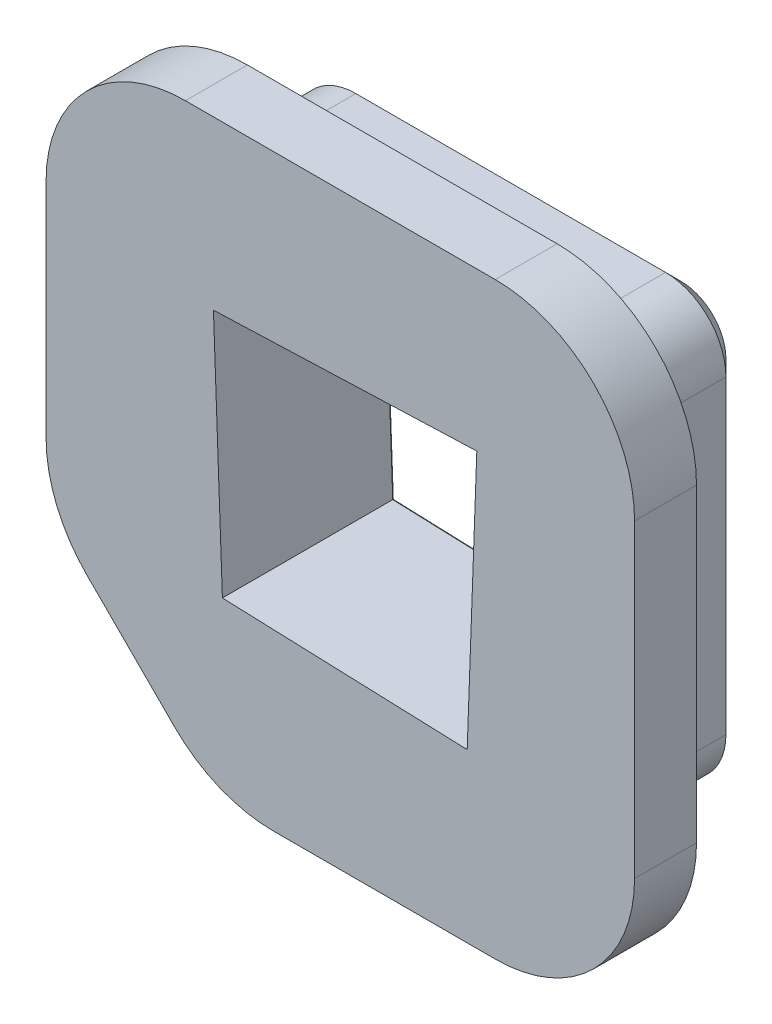
from build123d import *

# Parameters (mm, degrees)
BOSS_EXTRUDE1_DEPTH     = 2
BOSS_EXTRUDE2_DEPTH     = 4
CUT_EXTRUDE1_DEPTH      = 39.9548816
CUT_EXTRUDE1_DEPTH_BACK = 39.9548816
CHAMFER1_SIZE           = 0.5


with BuildPart() as part:
    # Sketch2 → Boss-Extrude1 (new body)
    with BuildSketch(Plane.XY):
        with BuildLine():
            Line((-26.081641102, -23.253213977), (-23.253213977, -26.081641102))
            ThreePointArc((-23.253213977, -26.081641102), (-21.793308907, -27.057118483), (-20.071233462, -27.399660586))
            Line((-20.071233462, -27.399660586), (-12.899660586, -27.399660586))
            ThreePointArc((-12.899660586, -27.399660586), (-9.717680071, -26.081641102), (-8.399660586, -22.899660586))
            Line((-8.399660586, -22.899660586), (-8.399660586, -12.899660586))
            ThreePointArc((-8.399660586, -12.899660586), (-9.717680071, -9.717680071), (-12.899660586, -8.399660586))
            Line((-12.899660586, -8.399660586), (-22.899660586, -8.399660586))
            ThreePointArc((-22.899660586, -8.399660586), (-26.081641102, -9.717680071), (-27.399660586, -12.899660586))
            Line((-27.399660586, -12.899660586), (-27.399660586, -20.071233462))
            ThreePointArc((-27.399660586, -20.071233462), (-27.057118483, -21.793308907), (-26.081641102, -23.253213977))
        make_face()
    extrude(amount=BOSS_EXTRUDE1_DEPTH)

    # Sketch1 → Boss-Extrude2 (add)
    with BuildSketch(Plane.XY):
        with BuildLine():
            Line((-12.899660586, -10.949660586), (-22.899660586, -10.949660586))
            ThreePointArc((-22.899660586, -10.949660586), (-24.27851881, -11.520802363), (-24.849660586, -12.899660586))
            Line((-24.849660586, -12.899660586), (-24.849660586, -20.071233462))
            ThreePointArc((-24.849660586, -20.071233462), (-24.701225675, -20.817466155), (-24.27851881, -21.450091685))
            Line((-24.27851881, -21.450091685), (-21.450091685, -24.27851881))
            ThreePointArc((-21.450091685, -24.27851881), (-20.817466155, -24.701225675), (-20.071233462, -24.849660586))
            Line((-20.071233462, -24.849660586), (-12.899660586, -24.849660586))
            ThreePointArc((-12.899660586, -24.849660586), (-11.520802363, -24.27851881), (-10.949660586, -22.899660586))
            Line((-10.949660586, -22.899660586), (-10.949660586, -12.899660586))
            ThreePointArc((-10.949660586, -12.899660586), (-11.520802363, -11.520802363), (-12.899660586, -10.949660586))
        make_face()
    extrude(amount=-BOSS_EXTRUDE2_DEPTH)

    # Sketch3 → Cut-Extrude1 (cut, two sides: drawn at the far end of the back side and taken through both)
    with BuildSketch(Plane.XY.offset(-CUT_EXTRUDE1_DEPTH_BACK)):
        Polygon((-21.995634526, -13.803686646), (-13.493013972, -13.493013972), (-13.803686646, -21.995634526), (-21.706864564, -21.706864564), align=None)
    extrude(amount=CUT_EXTRUDE1_DEPTH + CUT_EXTRUDE1_DEPTH_BACK, mode=Mode.SUBTRACT)

    # Chamfer1
    chamfer1_edges = [part.edges().sort_by_distance(p)[0] for p in [
        (-11.520802363, -11.520802363, -4),
        (-10.949660586, -17.899660586, -4),
        (-11.520802363, -24.27851881, -4),
        (-16.485447024, -24.849660586, -4),
        (-20.817466155, -24.701225675, -4),
        (-22.864305247, -22.864305247, -4),
        (-24.701225675, -20.817466155, -4),
        (-24.849660586, -16.485447024, -4),
        (-24.27851881, -11.520802363, -4),
        (-17.899660586, -10.949660586, -4),
        (-21.851249545, -17.755275605, -4),
        (-17.755275605, -21.851249545, -4),
        (-13.648350309, -17.744324249, -4),
        (-17.744324249, -13.648350309, -4),
    ]]
    chamfer(chamfer1_edges, length=CHAMFER1_SIZE)


solid = part.part
